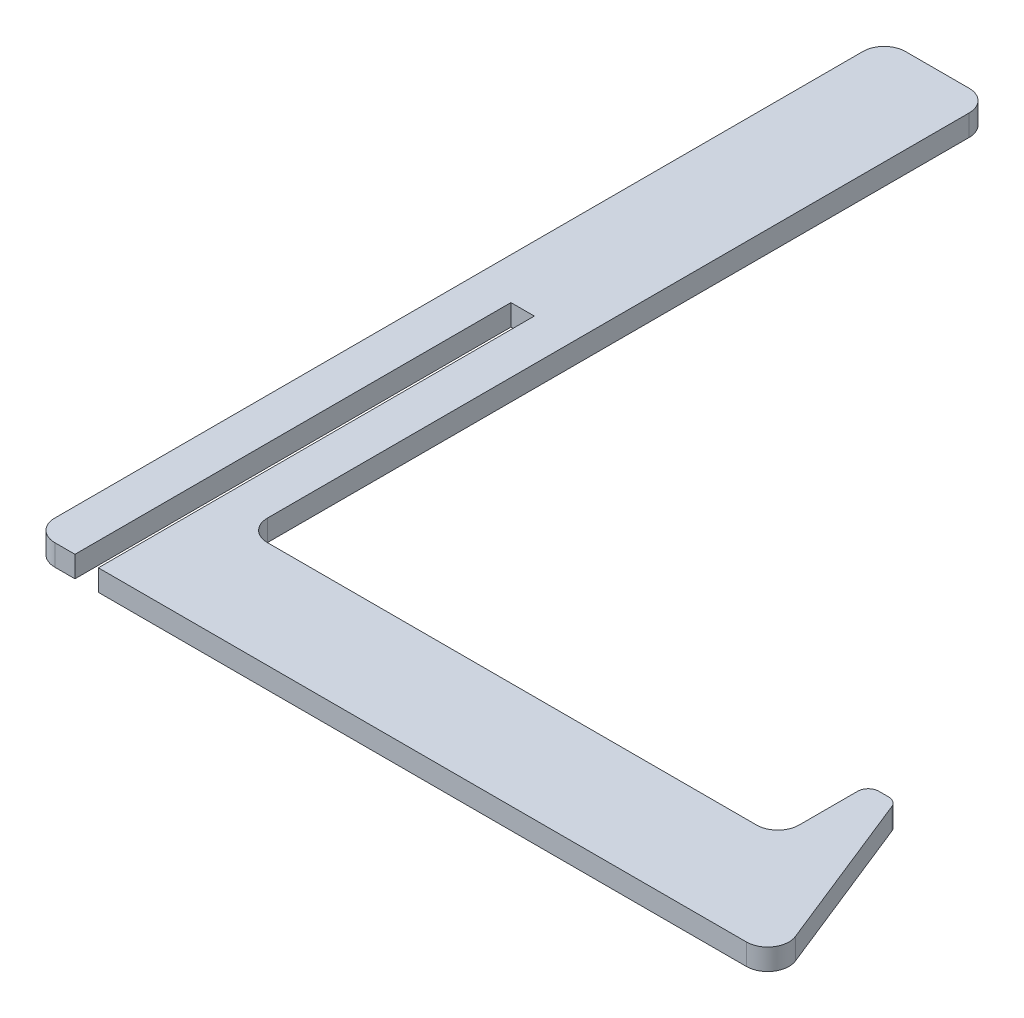
from build123d import *

# Parameters (mm, degrees)
BOSS_EXTRUDE1_DEPTH = 2
FILLET1_R           = 2
CUT_EXTRUDE1_DEPTH  = 106.694564726
FILLET2_R           = 1
SKETCH3_W           = 2.2
SKETCH3_H           = 41
CUT_EXTRUDE2_DEPTH  = 106.694564726


with BuildPart() as part:
    # Sketch1 → Boss-Extrude1 (new body)
    with BuildSketch(Plane(origin=(0, 0, 0), x_dir=(1, 0, 0), z_dir=(0, 1, 0))):
        Polygon((0, 0), (0, 80), (10, 80), (10, 10), (60, 10), (60, 25), (70, 0), align=None)
    extrude(amount=BOSS_EXTRUDE1_DEPTH)

    # Fillet1
    fillet1_edges = [part.edges().sort_by_distance(p)[0] for p in [
        (0, 1, 0),
        (0, 1, -80),
        (10, 1, -80),
        (10, 1, -10),
        (60, 1, -10),
        (70, 1, 0),
    ]]
    fillet(fillet1_edges, radius=FILLET1_R)

    # Sketch2 → Cut-Extrude1 (cut, through all)
    with BuildSketch(Plane(origin=(0, 2, 0), x_dir=(1, 0, 0), z_dir=(0, 1, 0))):
        Polygon((60, 18.5), (62.6, 18.5), (60, 25), align=None)
    extrude(amount=-CUT_EXTRUDE1_DEPTH, mode=Mode.SUBTRACT)

    # Fillet2
    fillet2_edges = [part.edges().sort_by_distance(p)[0] for p in [
        (60, 1, -18.5),
        (62.6, 1, -18.5),
    ]]
    fillet(fillet2_edges, radius=FILLET2_R)

    # Sketch3 → Cut-Extrude2 (cut, through all)
    with BuildSketch(Plane(origin=(0, 2, 0), x_dir=(1, 0, 0), z_dir=(0, 1, 0))):
        with Locations((5, 20.5)):
            Rectangle(SKETCH3_W, SKETCH3_H)
    extrude(amount=-CUT_EXTRUDE2_DEPTH, mode=Mode.SUBTRACT)


solid = part.part
